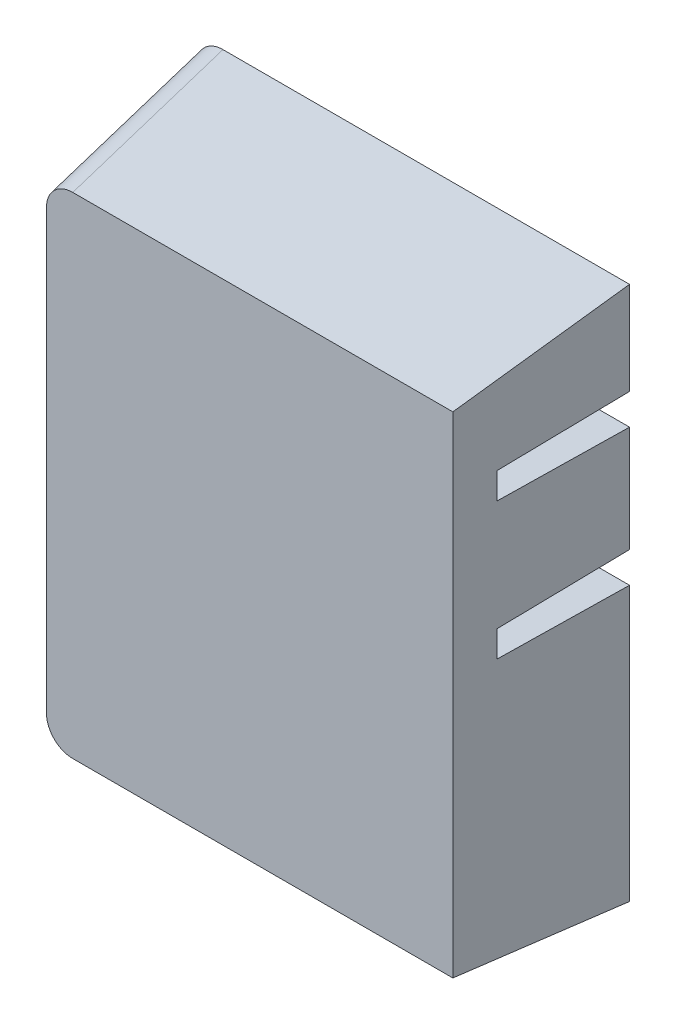
from build123d import *

# Parameters (mm, degrees)
ESQUISSE3_W                       = 60.424633044
ESQUISSE3_H                       = 3.5
ENL_V_MAT_EXTRU_3_DEPTH           = 15
ENL_V_MAT_EXTRU_3_DRAFT           = 1
ENL_V_MAT_EXTRU_3_PROFILE_2_DEPTH = 15
ENL_V_MAT_EXTRU_3_PROFILE_2_DRAFT = 1
ESQUISSE3_W_2                     = 42
ESQUISSE3_H_2                     = 3.2
ENL_V_MAT_EXTRU_3_PROFILE_3_DEPTH = 15
ENL_V_MAT_EXTRU_3_PROFILE_3_DRAFT = 1
CONG_1_R                          = 3


with BuildPart() as part:
    # Esquisse1 → Lissage1 section 0
    with BuildSketch(Plane.XY):
        with BuildLine():
            Line((-23, 27.75), (23, 27.75))
            Line((23, 27.75), (23, -27.75))
            Line((23, -27.75), (-23, -27.75))
            Line((-23, -27.75), (-23, 27.75))
        make_face()
    # Esquisse2 → Lissage1 section 1
    with BuildSketch(Plane.XY.offset(-20)):
        with BuildLine():
            Line((-26, 30.25), (23, 30.25))
            Line((23, 30.25), (23, -30.25))
            Line((23, -30.25), (-26, -30.25))
            Line((-26, -30.25), (-26, 30.25))
        make_face()
    loft()


with BuildPart() as enl_v_mat_extru_3_tool:
    # Esquisse3 → Enlèv. mat.-Extru.3 (with draft: the straight prism first)
    with BuildSketch(Plane.XY.offset(-20)):
        with Locations((-0.930868515, 2.5)):
            Rectangle(ESQUISSE3_W, ESQUISSE3_H)
    extrude(amount=ENL_V_MAT_EXTRU_3_DEPTH)
    # Enlèv. mat.-Extru.3: the draft: its side faces are tilted about the plane it starts from
    enl_v_mat_extru_3_sides = [enl_v_mat_extru_3_tool.faces().sort_by_distance(p)[0] for p in [
        (-0.930868515, 0.75, -12.5),
        (29.281448007, 2.5, -12.5),
        (-0.930868515, 4.25, -12.5),
        (-31.143185037, 2.5, -12.5),
    ]]
    draft(enl_v_mat_extru_3_sides, Plane.XY.offset(-20), ENL_V_MAT_EXTRU_3_DRAFT)


with BuildPart() as part_1:
    add(part.part)

    # Enlèv. mat.-Extru.3: cut by enl_v_mat_extru_3_tool
    add(enl_v_mat_extru_3_tool.part, mode=Mode.SUBTRACT)


with BuildPart() as enl_v_mat_extru_3_profile_2_tool:
    # Esquisse3 → Enlèv. mat.-Extru.3 profile 2 (with draft: the straight prism first)
    with BuildSketch(Plane.XY.offset(-20)):
        with Locations((-2.538455813, 18)):
            Rectangle(ESQUISSE3_W, ESQUISSE3_H)
    extrude(amount=ENL_V_MAT_EXTRU_3_PROFILE_2_DEPTH)
    # Enlèv. mat.-Extru.3 profile 2: the draft: its side faces are tilted about the plane it starts from
    enl_v_mat_extru_3_profile_2_sides = [enl_v_mat_extru_3_profile_2_tool.faces().sort_by_distance(p)[0] for p in [
        (-2.538455813, 16.25, -12.5),
        (27.673860709, 18, -12.5),
        (-2.538455813, 19.75, -12.5),
        (-32.750772335, 18, -12.5),
    ]]
    draft(enl_v_mat_extru_3_profile_2_sides, Plane.XY.offset(-20), ENL_V_MAT_EXTRU_3_PROFILE_2_DRAFT)


with BuildPart() as part_2:
    add(part_1.part)

    # Enlèv. mat.-Extru.3 profile 2: cut by enl_v_mat_extru_3_profile_2_tool
    add(enl_v_mat_extru_3_profile_2_tool.part, mode=Mode.SUBTRACT)


with BuildPart() as enl_v_mat_extru_3_profile_3_tool:
    # Esquisse3 → Enlèv. mat.-Extru.3 profile 3 (with draft: the straight prism first)
    with BuildSketch(Plane.XY.offset(-20)):
        with Locations((0, -15.85)):
            Rectangle(ESQUISSE3_W_2, ESQUISSE3_H_2)
    extrude(amount=ENL_V_MAT_EXTRU_3_PROFILE_3_DEPTH)
    # Enlèv. mat.-Extru.3 profile 3: the draft: its side faces are tilted about the plane it starts from
    enl_v_mat_extru_3_profile_3_sides = [enl_v_mat_extru_3_profile_3_tool.faces().sort_by_distance(p)[0] for p in [
        (0, -17.45, -12.5),
        (21, -15.85, -12.5),
        (0, -14.25, -12.5),
        (-21, -15.85, -12.5),
    ]]
    draft(enl_v_mat_extru_3_profile_3_sides, Plane.XY.offset(-20), ENL_V_MAT_EXTRU_3_PROFILE_3_DRAFT)


with BuildPart() as part_3:
    add(part_2.part)

    # Enlèv. mat.-Extru.3 profile 3: cut by enl_v_mat_extru_3_profile_3_tool
    add(enl_v_mat_extru_3_profile_3_tool.part, mode=Mode.SUBTRACT)

    # Congé1
    cong_1_edges = [part_3.edges().sort_by_distance(p)[0] for p in [
        (-24.5, 29, -10),
        (-24.5, -29, -10),
    ]]
    fillet(cong_1_edges, radius=CONG_1_R)


solid = part_3.part
